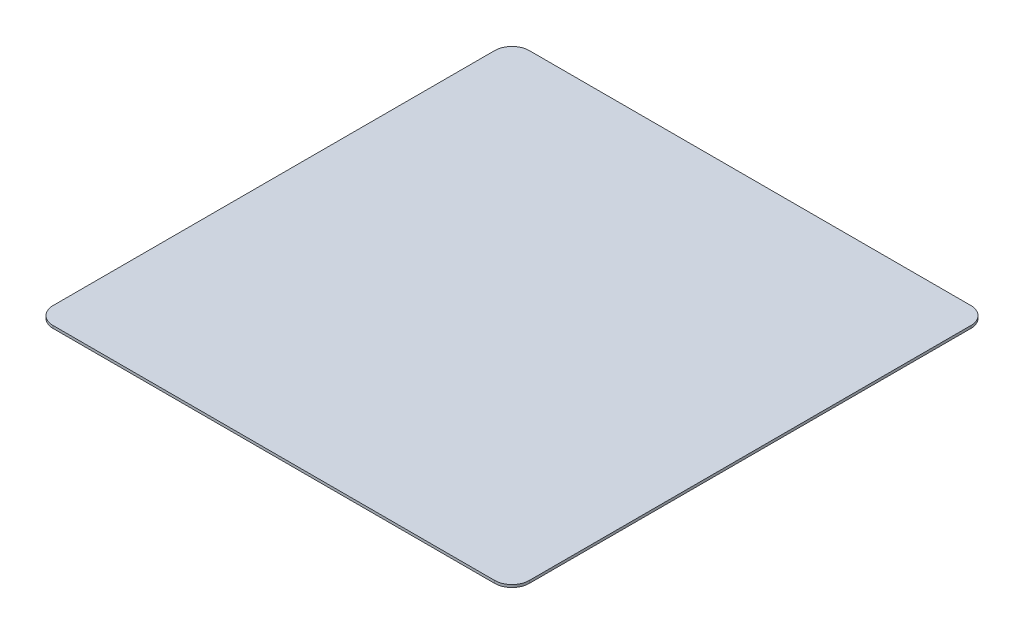
from build123d import *

# Parameters (mm, degrees)
BOSS_EXTRUDE1_DEPTH = 3


with BuildPart() as part:
    # Sketch1 → Boss-Extrude1 (new body)
    with BuildSketch(Plane(origin=(0, 0, 0), x_dir=(1, 0, 0), z_dir=(0, 1, 0))):
        with BuildLine():
            Line((-255, 275), (255, 275))
            ThreePointArc((255, 275), (269.142135624, 269.142135624), (275, 255))
            Line((275, 255), (275, -255))
            ThreePointArc((275, -255), (269.142135624, -269.142135624), (255, -275))
            Line((255, -275), (-255, -275))
            ThreePointArc((-255, -275), (-269.142135624, -269.142135624), (-275, -255))
            Line((-275, -255), (-275, 255))
            ThreePointArc((-275, 255), (-269.142135624, 269.142135624), (-255, 275))
        make_face()
    extrude(amount=BOSS_EXTRUDE1_DEPTH)


solid = part.part
